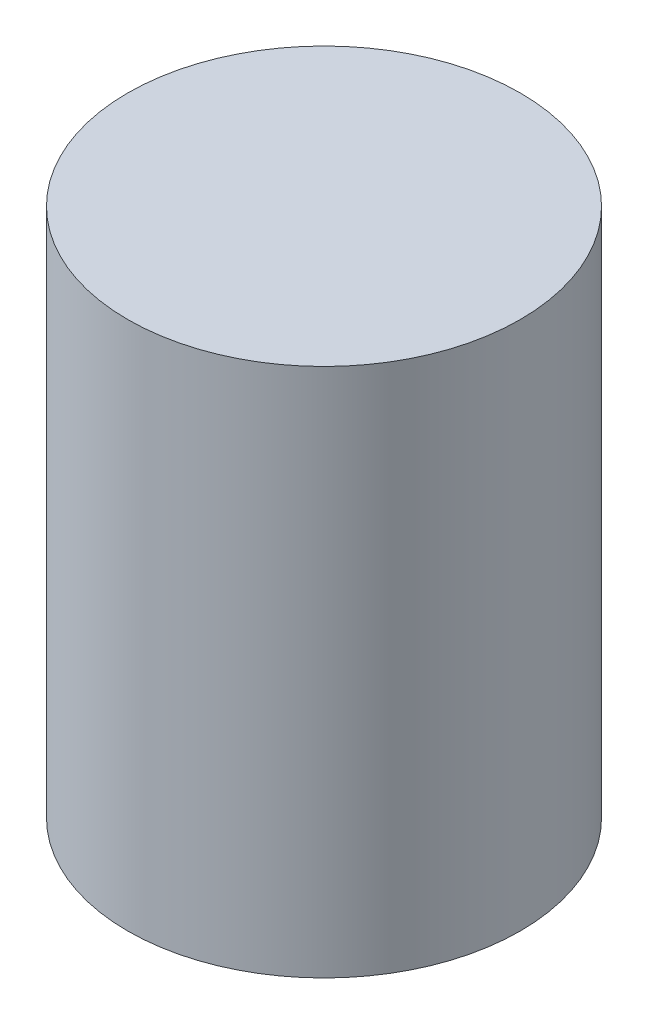
from build123d import *

# Parameters (mm, degrees)
CURVEBOSS_DEPTH      = 8.917
CURVEBOSS_DEPTH_BACK = 21.389
CURVESKETCH_R        = 11.231


with BuildPart() as part:
    # CurveSketch → CurveBoss (new, two sides: drawn at the far end of the back side and taken through both)
    with BuildSketch(Plane(origin=(0, 0, 0), x_dir=(1, 0, 0), z_dir=(0, 1, 0)).offset(-CURVEBOSS_DEPTH_BACK)):
        with Locations(Location((-6.193, 8.723, 0), (0, 0, 270))):
            Circle(CURVESKETCH_R)
    extrude(amount=CURVEBOSS_DEPTH + CURVEBOSS_DEPTH_BACK)


solid = part.part
